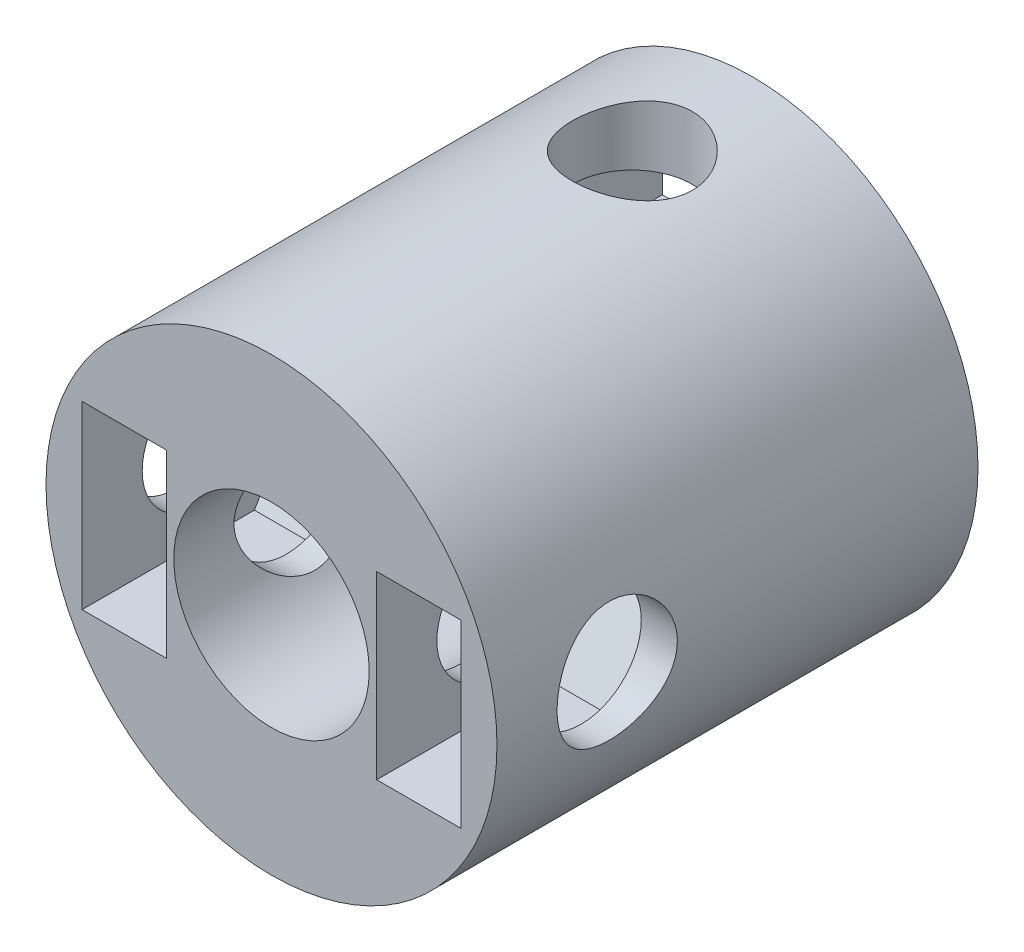
from build123d import *

# Parameters (mm, degrees)
CUT_EXTRUDE1_DEPTH      = 14.285330256
CUT_EXTRUDE1_DEPTH_BACK = 14.285330256
SKETCH4_R               = 2
CUT_EXTRUDE2_DEPTH      = 14.285330429
CUT_EXTRUDE2_DEPTH_BACK = 14.285330429
SKETCH5_R               = 2
CUT_EXTRUDE3_DEPTH      = 1.4
CUT_EXTRUDE4_DEPTH      = 1.4
CUT_EXTRUDE5_DEPTH      = 1.4
CUT_EXTRUDE6_DEPTH      = 1.4


with BuildPart() as part:
    # Sketch2 → Revolve1 (revolve)
    with BuildSketch(Plane(origin=(0, 0, 0), x_dir=(0, 0, -1), z_dir=(1, 0, 0)), mode=Mode.PRIVATE) as revolve1_sk:
        Polygon((8, 2.25), (0, 2.25), (0, 3.25), (-8, 3.25), (-8, 7.5), (8, 7.5), align=None)
    revolve(revolve1_sk.sketch.rotate(Axis((0, 0, 33.32637001), (0, 0, -1)), 90), axis=Axis((0, 0, 33.32637001), (0, 0, -1)))

    # Sketch4 → Cut-Extrude1 (cut, two sides: drawn at the far end of the back side and taken through both)
    with BuildSketch(Plane(origin=(0, 0, 0), x_dir=(1, 0, 0), z_dir=(0, 1, 0)).offset(-CUT_EXTRUDE1_DEPTH_BACK)):
        with Locations(Location((0, 4, 0), (0, 0, 270))):
            Circle(SKETCH4_R)
    extrude(amount=CUT_EXTRUDE1_DEPTH + CUT_EXTRUDE1_DEPTH_BACK, mode=Mode.SUBTRACT)

    # Sketch5 → Cut-Extrude2 (cut, two sides: drawn at the far end of the back side and taken through both)
    with BuildSketch(Plane(origin=(0, 0, 0), x_dir=(0, 0, -1), z_dir=(1, 0, 0)).offset(-CUT_EXTRUDE2_DEPTH_BACK)):
        with Locations((-4, 0)):
            Circle(SKETCH5_R)
    extrude(amount=CUT_EXTRUDE2_DEPTH + CUT_EXTRUDE2_DEPTH_BACK, mode=Mode.SUBTRACT)

    # Sketch6 → Cut-Extrude3 (cut, symmetric)
    with BuildSketch(Plane(origin=(4.9, 0, 0), x_dir=(0, 0, -1), z_dir=(1, 0, 0))):
        Polygon((-5.732050808, 3), (-8, 3), (-8, -3), (-5.732050808, -3), (-2.267949192, -3), (-0.535898385, 0), (-2.267949192, 3), align=None)
    extrude(amount=CUT_EXTRUDE3_DEPTH, both=True, mode=Mode.SUBTRACT)

    # Sketch7 → Cut-Extrude4 (cut, symmetric)
    with BuildSketch(Plane(origin=(-4.9, 0, 0), x_dir=(0, 0, -1), z_dir=(1, 0, 0))):
        Polygon((-5.732050808, 3), (-8, 3), (-8, -3), (-5.732050808, -3), (-2.267949192, -3), (-0.535898385, 0), (-2.267949192, 3), align=None)
    extrude(amount=CUT_EXTRUDE4_DEPTH, both=True, mode=Mode.SUBTRACT)

    # Sketch8 → Cut-Extrude5 (cut, symmetric)
    with BuildSketch(Plane(origin=(0, 4, 0), x_dir=(-1, 0, 0), z_dir=(0, 1, 0))):
        Polygon((3, -5.732050808), (3, -8), (-3, -8), (-3, -5.732050808), (-3, -2.267949192), (0, -0.535898385), (3, -2.267949192), align=None)
    extrude(amount=CUT_EXTRUDE5_DEPTH, both=True, mode=Mode.SUBTRACT)

    # Sketch9 → Cut-Extrude6 (cut, symmetric)
    with BuildSketch(Plane(origin=(0, -4, 0), x_dir=(-1, 0, 0), z_dir=(0, 1, 0))):
        Polygon((-3, -5.732050808), (-3, -8), (3, -8), (3, -5.732050808), (3, -2.267949192), (0, -0.535898385), (-3, -2.267949192), align=None)
    extrude(amount=CUT_EXTRUDE6_DEPTH, both=True, mode=Mode.SUBTRACT)


solid = part.part
